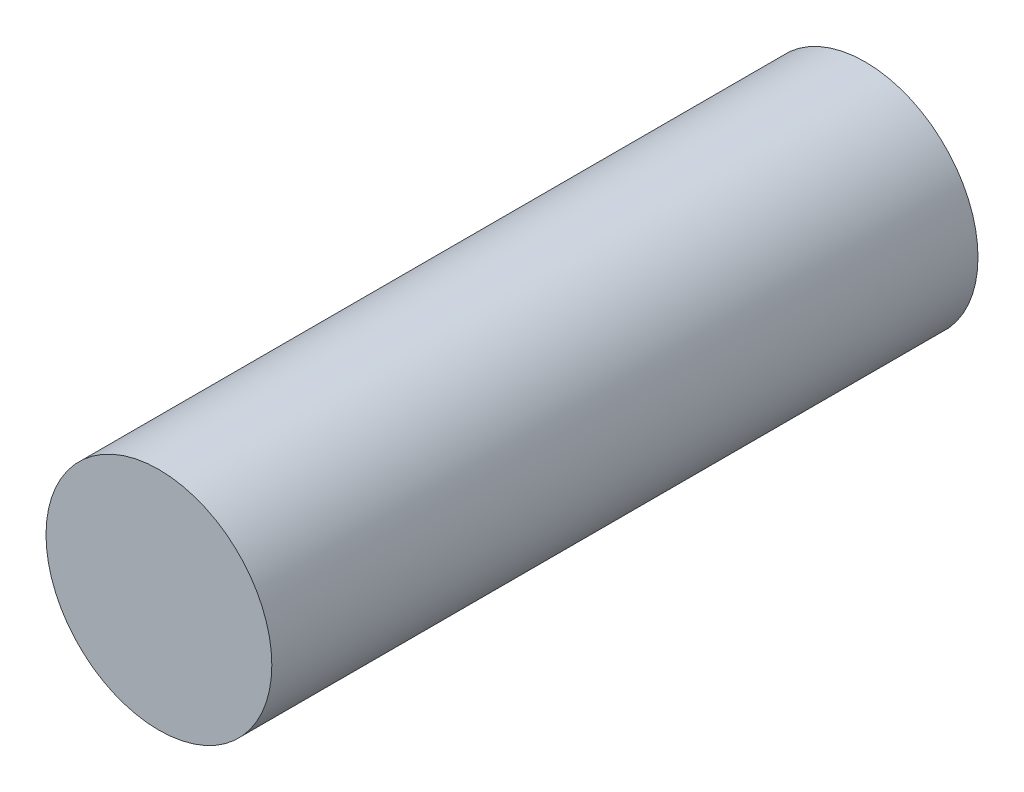
from build123d import *

# Parameters (mm, degrees)
SKETCH1_R           = 1.9939
BOSS_EXTRUDE1_DEPTH = 6.2357


with BuildPart() as part:
    # Sketch1 → Boss-Extrude1 (new, symmetric)
    with BuildSketch(Plane.XY):
        Circle(SKETCH1_R)
    extrude(amount=BOSS_EXTRUDE1_DEPTH, both=True)


solid = part.part
